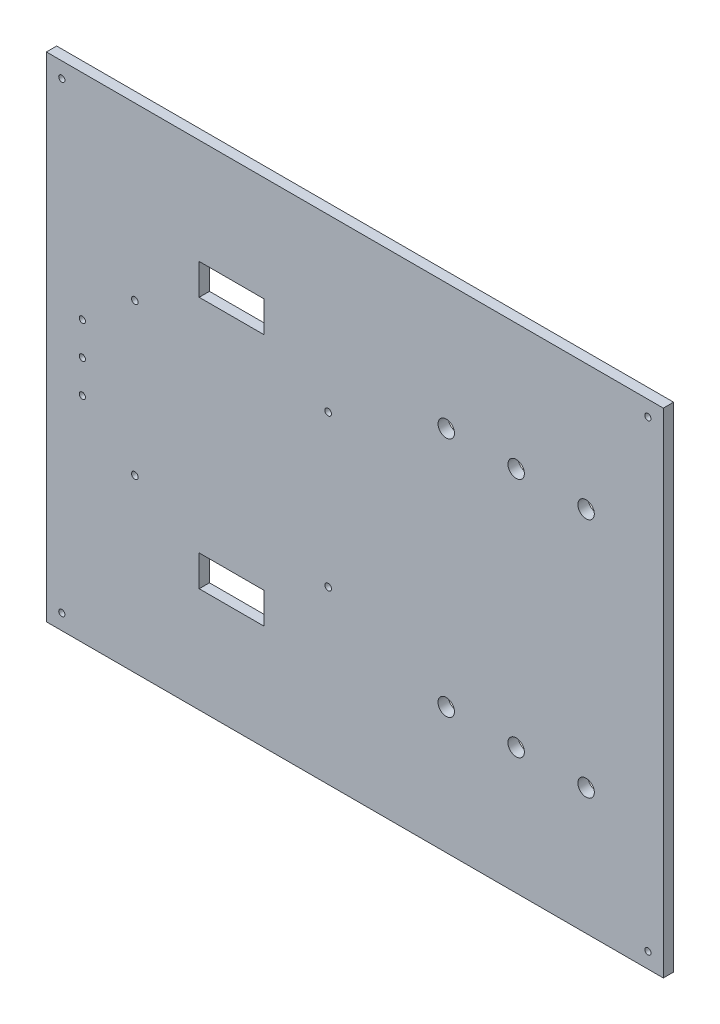
from build123d import *

# Parameters (mm, degrees)
SKETCH1_W           = 300
SKETCH1_H           = 240
SKETCH1_R           = 1.5
SKETCH1_R_2         = 1.6
SKETCH1_W_2         = 31.4
SKETCH1_H_2         = 15.09
BOSS_EXTRUDE1_DEPTH = 5
SKETCH3_R           = 1.5
CUT_EXTRUDE1_DEPTH  = 385.219989069
SKETCH5_R           = 4
CUT_EXTRUDE3_DEPTH  = 385.219989069
SKETCH8_R           = 4
CUT_EXTRUDE4_DEPTH  = 385.219989069


with BuildPart() as part:
    # Sketch1 → Boss-Extrude1 (new body)
    with BuildSketch(Plane.XY):
        with Locations((150, 120)):
            Rectangle(SKETCH1_W, SKETCH1_H)
        with Locations((7.5, 232.5)):
            Circle(SKETCH1_R, mode=Mode.SUBTRACT)
        with Locations(Location((292.5, 232.5, 0), (0, 0, 180))):
            Circle(SKETCH1_R, mode=Mode.SUBTRACT)
        with Locations((292.5, 7.5)):
            Circle(SKETCH1_R, mode=Mode.SUBTRACT)
        with Locations(Location((7.5, 7.5, 0), (0, 0, 180))):
            Circle(SKETCH1_R, mode=Mode.SUBTRACT)
        with Locations(Location((137, 156.83, 0), (0, 0, 180))):
            Circle(SKETCH1_R_2, mode=Mode.SUBTRACT)
        with Locations((43, 156.83)):
            Circle(SKETCH1_R_2, mode=Mode.SUBTRACT)
        with Locations(Location((43, 83.17, 0), (0, 0, 180))):
            Circle(SKETCH1_R_2, mode=Mode.SUBTRACT)
        with Locations((137, 83.17)):
            Circle(SKETCH1_R_2, mode=Mode.SUBTRACT)
        with Locations((90, 181.375)):
            Rectangle(SKETCH1_W_2, SKETCH1_H_2, mode=Mode.SUBTRACT)
        with Locations((90, 58.625)):
            Rectangle(SKETCH1_W_2, SKETCH1_H_2, mode=Mode.SUBTRACT)
    extrude(amount=BOSS_EXTRUDE1_DEPTH)

    # Sketch3 → Cut-Extrude1 (cut, through all)
    with BuildSketch(Plane.XY.offset(5)):
        with Locations(Location((17.484796486, 136, 0), (0, 0, 180))):
            Circle(SKETCH3_R)
        with Locations(Location((17.484796486, 120, 0), (0, 0, 180))):
            Circle(SKETCH3_R)
        with Locations(Location((17.484796486, 104, 0), (0, 0, 180))):
            Circle(SKETCH3_R)
    extrude(amount=-CUT_EXTRUDE1_DEPTH, mode=Mode.SUBTRACT)

    # Sketch5 → Cut-Extrude3 (cut, through all)
    with BuildSketch(Plane.XY.offset(5)):
        with Locations((194.442432224, 178.625000137)):
            Circle(SKETCH5_R)
        with Locations((228.442432224, 178.625000137)):
            Circle(SKETCH5_R)
        with Locations((262.442432224, 178.625000137)):
            Circle(SKETCH5_R)
    extrude(amount=-CUT_EXTRUDE3_DEPTH, mode=Mode.SUBTRACT)

    # Sketch8 → Cut-Extrude4 (cut, through all)
    with BuildSketch(Plane.XY.offset(5)):
        with Locations((194.442432224, 61.375000137)):
            Circle(SKETCH8_R)
        with Locations((228.442432224, 61.375000137)):
            Circle(SKETCH8_R)
        with Locations((262.442432224, 61.375000137)):
            Circle(SKETCH8_R)
    extrude(amount=-CUT_EXTRUDE4_DEPTH, mode=Mode.SUBTRACT)


solid = part.part
